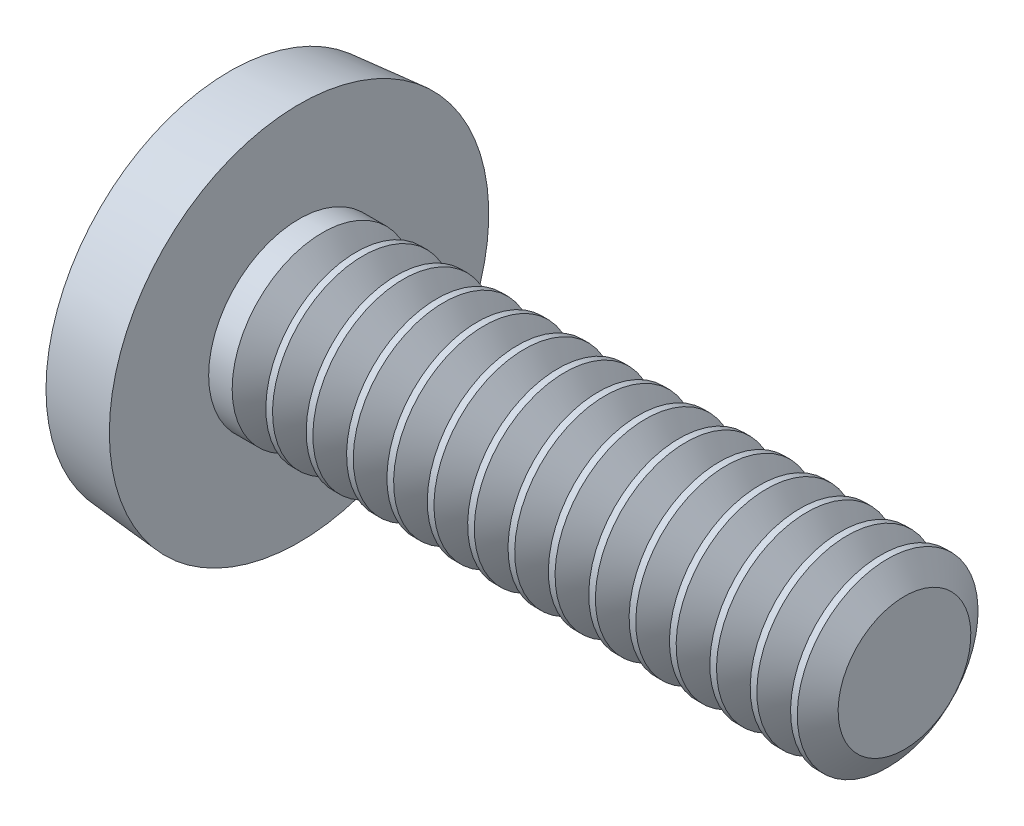
from build123d import *

# Parameters (mm, degrees)
CIRPATTERN1_COUNT = 2
CIRPATTERN1_ANGLE = 90
THDSCHPAT_COUNT   = 15
THDSCHPAT_PITCH   = 0.635


with BuildPart() as part:
    # BodySke → Base-Revolve (revolve)
    with BuildSketch(Plane.XY, mode=Mode.PRIVATE) as base_revolve_sk:
        with BuildLine():
            Line((1.7272, 1.4224), (1.7272, 2.9845))
            Line((1.7272, 2.9845), (0.635, 2.888944882))
            ThreePointArc((0.635, 2.888944882), (0.160622478, 1.478954659), (0, 0))
            Line((0, 0), (11.2522, 0))
            Line((11.2522, 0), (11.2522, 1.4224))
            Line((11.2522, 1.4224), (1.7272, 1.4224))
        make_face()
    revolve(base_revolve_sk.sketch.rotate(Axis((-25.4, 0, 0), (1, 0, 0)), 90), axis=Axis((-25.4, 0, 0), (1, 0, 0)))

    # Sketch3 → Cross section 0
    with BuildSketch(Plane(origin=(0, 0, 0), x_dir=(0, 0, -1), z_dir=(1, 0, 0))):
        with BuildLine():
            Line((-0.4318, 1.9558), (0.4318, 1.9558))
            Line((0.4318, 1.9558), (0.4318, -1.9558))
            Line((0.4318, -1.9558), (-0.4318, -1.9558))
            Line((-0.4318, -1.9558), (-0.4318, 1.9558))
        make_face()
    # Sketch4 → Cross section 1
    with BuildSketch(Plane(origin=(2.1844, 0, 0), x_dir=(0, 0, -1), z_dir=(1, 0, 0))):
        with BuildLine():
            Line((-0.2159, 0.2159), (0.2159, 0.2159))
            Line((0.2159, 0.2159), (0.2159, -0.2159))
            Line((0.2159, -0.2159), (-0.2159, -0.2159))
            Line((-0.2159, -0.2159), (-0.2159, 0.2159))
        make_face()
    cross = loft(mode=Mode.SUBTRACT)

    # CirPattern1: Cross ×2 about axis
    cirpattern1_axis = Axis((0, 0, 0), (1, 0, 0))
    for i in range(1, CIRPATTERN1_COUNT):
        add(cross.rotate(cirpattern1_axis, i * CIRPATTERN1_ANGLE / (CIRPATTERN1_COUNT - 1)), mode=Mode.SUBTRACT)

    # ThdSchSke → ThreadSchematic (revolve, cut)
    with BuildSketch(Plane.XY):
        Polygon((2.3622, -1.04394), (2.097199455, -1.4224), (2.097199455, -1.778), (2.627200545, -1.778), (2.627200545, -1.4224), align=None)
    threadschematic = revolve(axis=Axis((-3.175, 0, 0), (1, 0, 0)), mode=Mode.SUBTRACT)

    # ThdSchPat: ThreadSchematic ×15
    with Locations(*[(i * THDSCHPAT_PITCH, 0, 0) for i in range(1, THDSCHPAT_COUNT)]):
        add(threadschematic, mode=Mode.SUBTRACT)


solid = part.part
